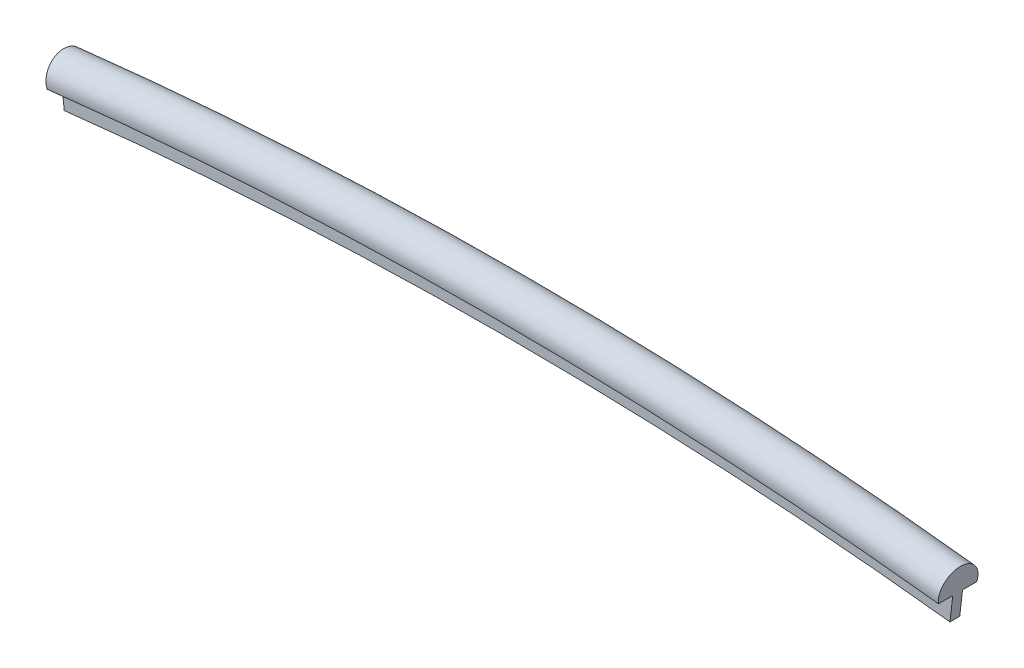
from build123d import *

# Parameters (mm, degrees)
REVOLVE1_ANGLE           = 6.526215624
REVOLVE1_OTHER_WAY_ANGLE = 6.526215624


with BuildPart() as part:
    # Sketch2 → Revolve1 (revolve)
    with BuildSketch(Plane(origin=(0, 0, 0), x_dir=(0, 0, -1), z_dir=(1, 0, 0))):
        with BuildLine():
            Line((0, 239.8), (0.3, 239.8))
            Line((0.3, 239.8), (0.3, 241.3))
            Line((0.3, 241.3), (1.18, 241.3))
            ThreePointArc((1.18, 241.3), (0, 242.800182019), (-1.18, 241.3))
            Line((-1.18, 241.3), (-0.3, 241.3))
            Line((-0.3, 241.3), (-0.3, 239.8))
            Line((-0.3, 239.8), (0, 239.8))
        make_face()
    revolve(axis=Axis((0, 0, 70.597641597), (0, 0, -1)), revolution_arc=REVOLVE1_ANGLE)

    # Sketch2 → Revolve1 other way (revolve)
    with BuildSketch(Plane(origin=(0, 0, 0), x_dir=(0, 0, -1), z_dir=(1, 0, 0))):
        with BuildLine():
            Line((0, 239.8), (0.3, 239.8))
            Line((0.3, 239.8), (0.3, 241.3))
            Line((0.3, 241.3), (1.18, 241.3))
            ThreePointArc((1.18, 241.3), (0, 242.800182019), (-1.18, 241.3))
            Line((-1.18, 241.3), (-0.3, 241.3))
            Line((-0.3, 241.3), (-0.3, 239.8))
            Line((-0.3, 239.8), (0, 239.8))
        make_face()
    revolve(axis=Axis((0, 0, 70.597641597), (0, 0, 1)), revolution_arc=REVOLVE1_OTHER_WAY_ANGLE)


solid = part.part
